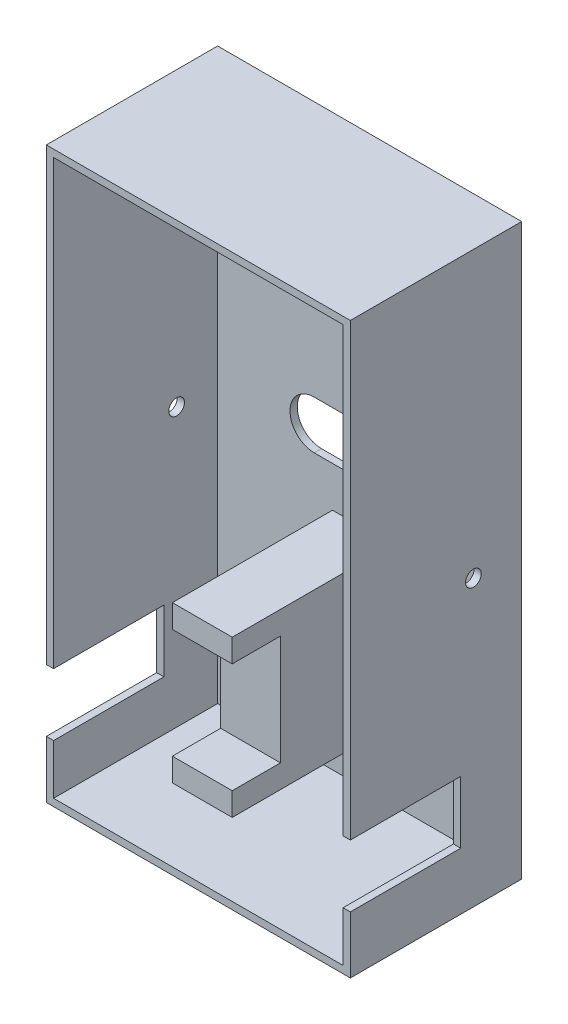
from build123d import *

# Parameters (mm, degrees)
SKETCH1_W                  = 63
SKETCH1_H                  = 118
BOSS_EXTRUDE1_DEPTH        = 35.5
SKETCH2_W                  = 60
SKETCH2_H                  = 115
CUT_EXTRUDE1_DEPTH         = 34
SKETCH3_W                  = 12.4
SKETCH3_H                  = 3.3
SKETCH3_H_2                = 1.5
SKETCH3_H_3                = 22.75
BOSS_EXTRUDE2_DEPTH        = 33.18
CUT_EXTRUDE2_REACH         = 129.081
SKETCH4_W                  = 10
SKETCH4_H                  = 22.75
CUT_EXTRUDE3_REACH         = 138.738
SKETCH5_W                  = 22.87
SKETCH5_H                  = 12.89
CUT_EXTRUDE4_REACH         = 138.738
SKETCH6_W                  = 22.87
SKETCH6_H                  = 12.89
CUT_EXTRUDE5_DEPTH         = 137.435882377
M2_5_CLEARANCE_HOLE1_D     = 3.05
M2_5_CLEARANCE_HOLE1_DEPTH = 35.5
M3_CLEARANCE_HOLE1_D       = 3.2512
M3_CLEARANCE_HOLE1_DEPTH   = 1.5
M3_CLEARANCE_HOLE2_D       = 3.2512
M3_CLEARANCE_HOLE2_DEPTH   = 63


with BuildPart() as part:
    # Sketch1 → Boss-Extrude1 (new body)
    with BuildSketch(Plane.XY.offset(34)):
        with Locations((30, 57.5)):
            Rectangle(SKETCH1_W, SKETCH1_H)
    extrude(amount=-BOSS_EXTRUDE1_DEPTH)

    # Sketch2 → Cut-Extrude1 (cut)
    with BuildSketch(Plane.XY.offset(34)):
        with Locations((30, 57.5)):
            Rectangle(SKETCH2_W, SKETCH2_H)
    extrude(amount=-CUT_EXTRUDE1_DEPTH, mode=Mode.SUBTRACT)

    # Sketch3 → Boss-Extrude2 (add)
    with BuildSketch(Plane.XY):
        with Locations((30, 15.9)):
            Rectangle(SKETCH3_W, SKETCH3_H)
        with Locations((30, 18.3)):
            Rectangle(SKETCH3_W, SKETCH3_H_2)
        with Locations((30, 30.425)):
            Rectangle(SKETCH3_W, SKETCH3_H_3)
        with Locations((30, 44.95)):
            Rectangle(SKETCH3_W, SKETCH3_H)
        with Locations((30, 42.55)):
            Rectangle(SKETCH3_W, SKETCH3_H_2)
    extrude(amount=BOSS_EXTRUDE2_DEPTH)

    # Sketch4 → Cut-Extrude2 (cut, up to next)
    with BuildSketch(Plane.ZY.offset(-23.8), mode=Mode.PRIVATE) as cut_extrude2_sk1:
        with Locations((28.18, 30.425)):
            Rectangle(SKETCH4_W, SKETCH4_H)
    cut_extrude2_tool1 = extrude(cut_extrude2_sk1.sketch, amount=-CUT_EXTRUDE2_REACH, mode=Mode.PRIVATE) & part.part
    add(cut_extrude2_tool1.solids().sort_by_distance((23.8, 30.425, 28.18))[0], mode=Mode.SUBTRACT)

    # Sketch5 → Cut-Extrude3 (cut, up to next)
    with BuildSketch(Plane(origin=(61.5, 0, 0), x_dir=(0, 0, -1), z_dir=(1, 0, 0)), mode=Mode.PRIVATE) as cut_extrude3_sk1:
        with Locations((-22.565, 16.805)):
            Rectangle(SKETCH5_W, SKETCH5_H)
    cut_extrude3_tool1 = extrude(cut_extrude3_sk1.sketch, amount=-CUT_EXTRUDE3_REACH, mode=Mode.PRIVATE) & part.part
    add(cut_extrude3_tool1.solids().sort_by_distance((61.5, 16.805, 22.565))[0], mode=Mode.SUBTRACT)

    # Sketch6 → Cut-Extrude4 (cut, up to next)
    with BuildSketch(Plane.ZY.offset(1.5), mode=Mode.PRIVATE) as cut_extrude4_sk1:
        with Locations((22.565, 16.805)):
            Rectangle(SKETCH6_W, SKETCH6_H)
    cut_extrude4_tool1 = extrude(cut_extrude4_sk1.sketch, amount=-CUT_EXTRUDE4_REACH, mode=Mode.PRIVATE) & part.part
    add(cut_extrude4_tool1.solids().sort_by_distance((-1.5, 16.805, 22.565))[0], mode=Mode.SUBTRACT)

    # Sketch7 → Cut-Extrude5 (cut, through all)
    with BuildSketch(Plane(origin=(0, 0, -1.5), x_dir=(-1, 0, 0), z_dir=(0, 0, -1))):
        with BuildLine():
            Line((-40, 55), (-20, 55))
            ThreePointArc((-20, 55), (-15, 60), (-20, 65))
            Line((-20, 65), (-40, 65))
            ThreePointArc((-40, 65), (-45, 60), (-40, 55))
        make_face()
    extrude(amount=-CUT_EXTRUDE5_DEPTH, mode=Mode.SUBTRACT)

    # M2.5 Clearance Hole1
    with Locations(Plane(origin=(0, 0, -1.5), x_dir=(-1, 0, 0), z_dir=(0, 0, -1))):
        with Locations((-9.95, 28.42), (-9.95, 21.935), (-50.05, 28.42), (-50.05, 21.935)):
            Hole(M2_5_CLEARANCE_HOLE1_D / 2, depth=M2_5_CLEARANCE_HOLE1_DEPTH)

    # M3 Clearance Hole1
    with Locations(Plane(origin=(0, 0, 0), x_dir=(0, 0, -1), z_dir=(1, 0, 0))):
        with Locations((-8.5, 57.5)):
            Hole(M3_CLEARANCE_HOLE1_D / 2, depth=M3_CLEARANCE_HOLE1_DEPTH)

    # M3 Clearance Hole2
    with Locations(Plane(origin=(61.5, 0, 0), x_dir=(0, 0, -1), z_dir=(1, 0, 0))):
        with Locations((-8.5, 57.5)):
            Hole(M3_CLEARANCE_HOLE2_D / 2, depth=M3_CLEARANCE_HOLE2_DEPTH)


solid = part.part
